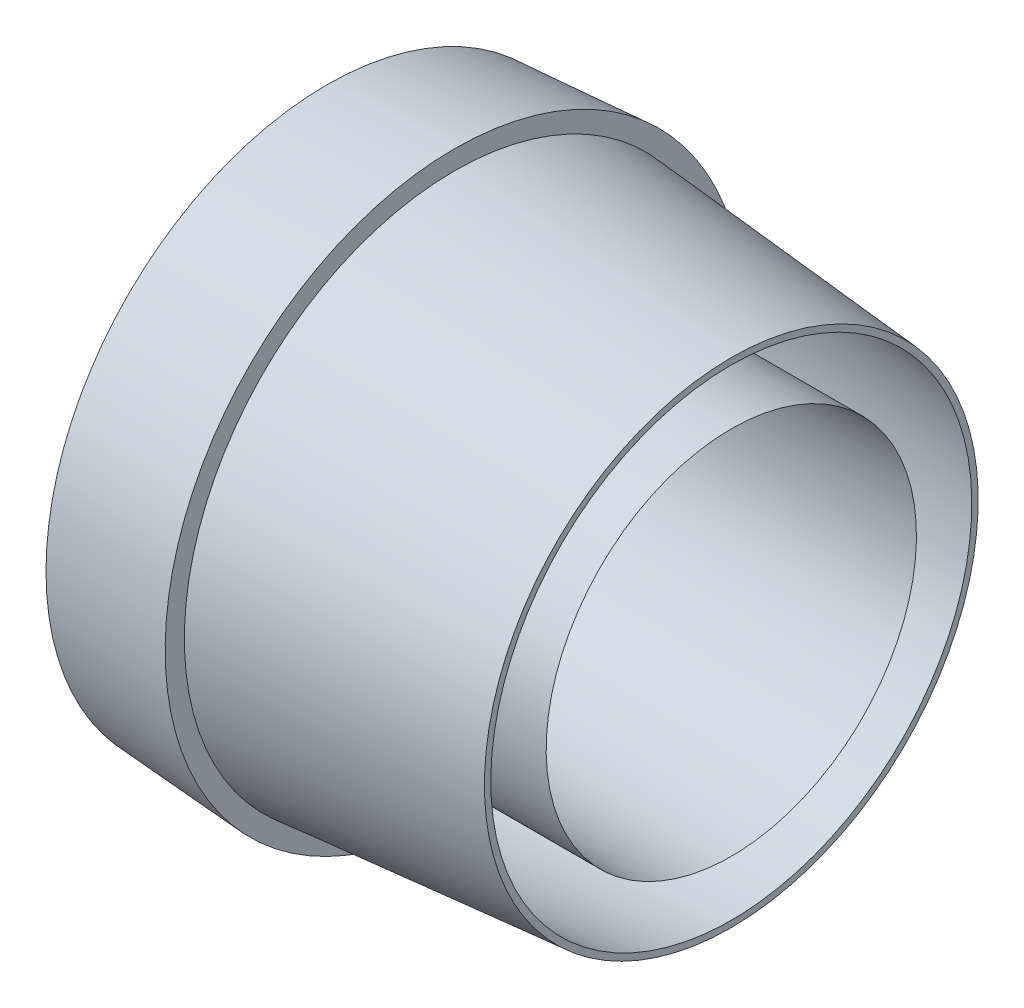
from build123d import *

# Parameters (mm, degrees)
REVOLVE1_ANGLE = 359.999999589
REVOLVE2_ANGLE = 359.999999589
REVOLVE3_ANGLE = 359.999999589


with BuildPart() as part:
    # Sketch1 → Revolve1 (revolve)
    with BuildSketch(Plane.XY):
        Polygon((3400, 350), (3400, 660), (3700, 680), (3700, 380), align=None)
    revolve(axis=Axis((0, 0, 0), (1, 0, 0)), revolution_arc=REVOLVE1_ANGLE)


with BuildPart() as body_2:
    # Sketch2 → Revolve2 (revolve)
    with BuildSketch(Plane.XY):
        Polygon((3700, 620), (3700, 635), (4350, 580), (4350, 565), align=None)
    revolve(axis=Axis((0, 0, 0), (1, 0, 0)), revolution_arc=REVOLVE2_ANGLE)


with BuildPart() as body_3:
    # Sketch3 → Revolve3 (revolve)
    with BuildSketch(Plane.XY):
        Polygon((3700, 420), (3700, 435), (4350, 435), align=None)
    revolve(axis=Axis((0, 0, 0), (1, 0, 0)), revolution_arc=REVOLVE3_ANGLE)


solid = Compound([part.part, body_2.part, body_3.part])
